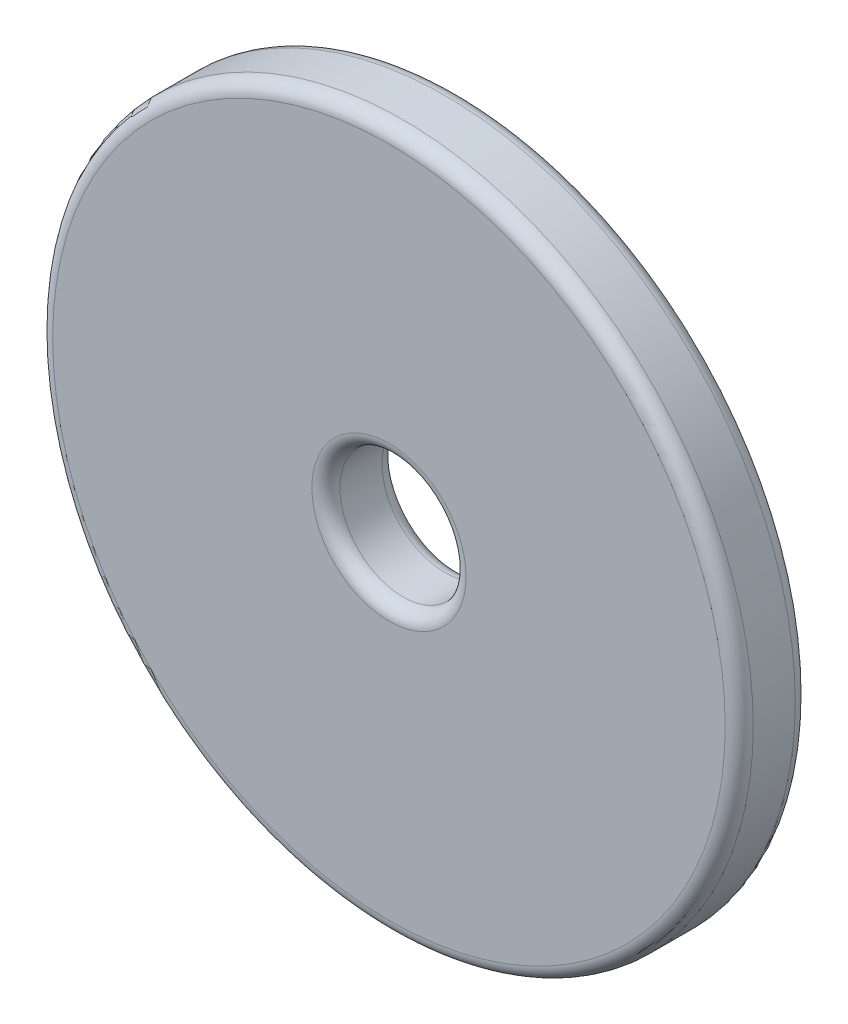
from build123d import *

# Parameters (mm, degrees)
SKETCH1_R               = 45
SKETCH1_R_2             = 2.25
SKETCH1_R_3             = 1.75
BOSS_EXTRUDE1_DEPTH     = 2.5
SKETCH2_R               = 29.85
SKETCH2_R_2             = 12.65
BOSS_EXTRUDE2_DEPTH     = 1
CUT_EXTRUDE1_DEPTH      = 64.688696014
CUT_EXTRUDE1_DEPTH_BACK = 64.688696014
SKETCH3_R               = 45
SKETCH3_R_2             = 12.5
FILLET1_R               = 0.5


with BuildPart() as part:
    # Sketch1 → Boss-Extrude1 (new body)
    with BuildSketch(Plane.XY):
        Circle(SKETCH1_R)
        Circle(SKETCH1_R_2, mode=Mode.SUBTRACT)
        with Locations((0, 33.5)):
            Circle(SKETCH1_R_3, mode=Mode.SUBTRACT)
        with Locations((33.5, 0)):
            Circle(SKETCH1_R_3, mode=Mode.SUBTRACT)
        with Locations((0, -33.5)):
            Circle(SKETCH1_R_3, mode=Mode.SUBTRACT)
        with Locations((-33.5, 0)):
            Circle(SKETCH1_R_3, mode=Mode.SUBTRACT)
    extrude(amount=BOSS_EXTRUDE1_DEPTH)

    # Sketch2 → Boss-Extrude2 (add)
    with BuildSketch(Plane(origin=(0, 0, 0), x_dir=(-1, 0, 0), z_dir=(0, 0, -1))):
        Circle(SKETCH2_R)
        Circle(SKETCH2_R_2, mode=Mode.SUBTRACT)
    extrude(amount=BOSS_EXTRUDE2_DEPTH)

    # Sketch3 → Cut-Extrude1 (cut, two sides: drawn at the far end of the back side and taken through both)
    with BuildSketch(Plane.XY.offset(-CUT_EXTRUDE1_DEPTH_BACK)):
        Circle(SKETCH3_R)
        Circle(SKETCH3_R_2, mode=Mode.SUBTRACT)
    extrude(amount=CUT_EXTRUDE1_DEPTH + CUT_EXTRUDE1_DEPTH_BACK, mode=Mode.SUBTRACT)

    # Fillet1
    fillet1_edges = [part.edges().sort_by_distance(p)[0] for p in [
        (-12.5, 0, 2.5),
        (-12.5, 0, 0),
        (-2.25, 0, 0),
        (-2.25, 0, 2.5),
    ]]
    fillet(fillet1_edges, radius=FILLET1_R)


solid = part.part
